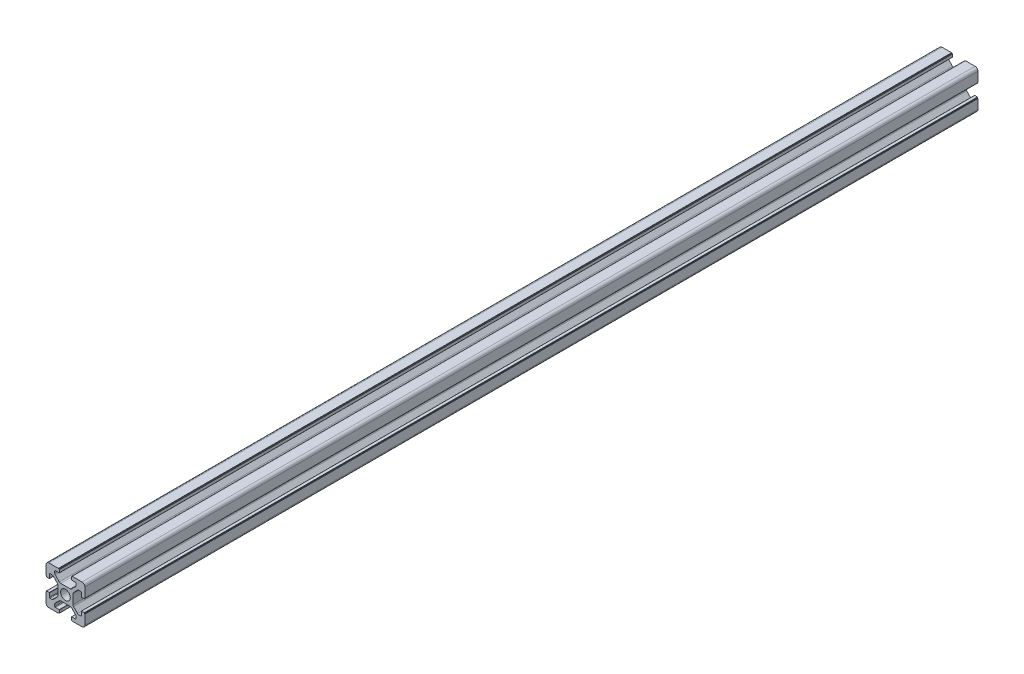
from build123d import *

# Parameters (mm, degrees)
SKETCH_1_R      = 2.5
EXTRUDE_1_DEPTH = 460
FILLET_1_R      = 1.5


with BuildPart() as part:
    # 草图1 → 凸台-拉伸1 (new body)
    with BuildSketch(Plane.XY):
        with BuildLine():
            Line((20, 13.6), (20, 20))
            Line((20, 20), (13.6, 20))
            Line((13.6, 20), (13.6, 19.8))
            Line((13.6, 19.8), (13.2, 19.8))
            ThreePointArc((13.2, 19.8), (13.129289322, 19.770710678), (13.1, 19.7))
            Line((13.1, 19.7), (13.1, 18.3))
            ThreePointArc((13.1, 18.3), (13.129289322, 18.229289322), (13.2, 18.2))
            Line((13.2, 18.2), (15.2, 18.2))
            ThreePointArc((15.2, 18.2), (15.412132034, 18.112132034), (15.5, 17.9))
            Line((15.5, 17.9), (15.5, 16.974873734))
            ThreePointArc((15.5, 16.974873734), (15.423879533, 16.592190302), (15.207106781, 16.267766953))
            Line((15.207106781, 16.267766953), (13.132233047, 14.192893219))
            ThreePointArc((13.132233047, 14.192893219), (12.807809698, 13.976120467), (12.425126266, 13.9))
            Line((12.425126266, 13.9), (7.574873734, 13.9))
            ThreePointArc((7.574873734, 13.9), (7.192190302, 13.976120467), (6.867766953, 14.192893219))
            Line((6.867766953, 14.192893219), (4.792893219, 16.267766953))
            ThreePointArc((4.792893219, 16.267766953), (4.576120467, 16.592190302), (4.5, 16.974873734))
            Line((4.5, 16.974873734), (4.5, 17.9))
            ThreePointArc((4.5, 17.9), (4.587867966, 18.112132034), (4.8, 18.2))
            Line((4.8, 18.2), (6.8, 18.2))
            ThreePointArc((6.8, 18.2), (6.870710678, 18.229289322), (6.9, 18.3))
            Line((6.9, 18.3), (6.9, 19.7))
            ThreePointArc((6.9, 19.7), (6.870710678, 19.770710678), (6.8, 19.8))
            Line((6.8, 19.8), (6.4, 19.8))
            Line((6.4, 19.8), (6.4, 20))
            Line((6.4, 20), (0, 20))
            Line((0, 20), (0, 13.6))
            Line((0, 13.6), (0.2, 13.6))
            Line((0.2, 13.6), (0.2, 13.2))
            ThreePointArc((0.2, 13.2), (0.229289322, 13.129289322), (0.3, 13.1))
            Line((0.3, 13.1), (1.7, 13.1))
            ThreePointArc((1.7, 13.1), (1.770710678, 13.129289322), (1.8, 13.2))
            Line((1.8, 13.2), (1.8, 15.2))
            ThreePointArc((1.8, 15.2), (1.887867966, 15.412132034), (2.1, 15.5))
            Line((2.1, 15.5), (3.025126266, 15.5))
            ThreePointArc((3.025126266, 15.5), (3.407809698, 15.423879533), (3.732233047, 15.207106781))
            Line((3.732233047, 15.207106781), (5.807106781, 13.132233047))
            ThreePointArc((5.807106781, 13.132233047), (6.023879533, 12.807809698), (6.1, 12.425126266))
            Line((6.1, 12.425126266), (6.1, 7.574873734))
            ThreePointArc((6.1, 7.574873734), (6.023879533, 7.192190302), (5.807106781, 6.867766953))
            Line((5.807106781, 6.867766953), (3.732233047, 4.792893219))
            ThreePointArc((3.732233047, 4.792893219), (3.407809698, 4.576120467), (3.025126266, 4.5))
            Line((3.025126266, 4.5), (2.1, 4.5))
            ThreePointArc((2.1, 4.5), (1.887867966, 4.587867966), (1.8, 4.8))
            Line((1.8, 4.8), (1.8, 6.8))
            ThreePointArc((1.8, 6.8), (1.770710678, 6.870710678), (1.7, 6.9))
            Line((1.7, 6.9), (0.3, 6.9))
            ThreePointArc((0.3, 6.9), (0.229289322, 6.870710678), (0.2, 6.8))
            Line((0.2, 6.8), (0.2, 6.4))
            Line((0.2, 6.4), (0, 6.4))
            Line((0, 6.4), (0, 0))
            Line((0, 0), (6.4, 0))
            Line((6.4, 0), (6.4, 0.2))
            Line((6.4, 0.2), (6.8, 0.2))
            ThreePointArc((6.8, 0.2), (6.870710678, 0.229289322), (6.9, 0.3))
            Line((6.9, 0.3), (6.9, 1.7))
            ThreePointArc((6.9, 1.7), (6.870710678, 1.770710678), (6.8, 1.8))
            Line((6.8, 1.8), (4.8, 1.8))
            ThreePointArc((4.8, 1.8), (4.587867966, 1.887867966), (4.5, 2.1))
            Line((4.5, 2.1), (4.5, 3.025126266))
            ThreePointArc((4.5, 3.025126266), (4.576120467, 3.407809698), (4.792893219, 3.732233047))
            Line((4.792893219, 3.732233047), (6.867766953, 5.807106781))
            ThreePointArc((6.867766953, 5.807106781), (7.192190302, 6.023879533), (7.574873734, 6.1))
            Line((7.574873734, 6.1), (12.425126266, 6.1))
            ThreePointArc((12.425126266, 6.1), (12.807809698, 6.023879533), (13.132233047, 5.807106781))
            Line((13.132233047, 5.807106781), (15.207106781, 3.732233047))
            ThreePointArc((15.207106781, 3.732233047), (15.423879533, 3.407809698), (15.5, 3.025126266))
            Line((15.5, 3.025126266), (15.5, 2.1))
            ThreePointArc((15.5, 2.1), (15.412132034, 1.887867966), (15.2, 1.8))
            Line((15.2, 1.8), (13.2, 1.8))
            ThreePointArc((13.2, 1.8), (13.129289322, 1.770710678), (13.1, 1.7))
            Line((13.1, 1.7), (13.1, 0.3))
            ThreePointArc((13.1, 0.3), (13.129289322, 0.229289322), (13.2, 0.2))
            Line((13.2, 0.2), (13.6, 0.2))
            Line((13.6, 0.2), (13.6, 0))
            Line((13.6, 0), (20, 0))
            Line((20, 0), (20, 6.4))
            Line((20, 6.4), (19.8, 6.4))
            Line((19.8, 6.4), (19.8, 6.8))
            ThreePointArc((19.8, 6.8), (19.770710678, 6.870710678), (19.7, 6.9))
            Line((19.7, 6.9), (18.3, 6.9))
            ThreePointArc((18.3, 6.9), (18.229289322, 6.870710678), (18.2, 6.8))
            Line((18.2, 6.8), (18.2, 4.8))
            ThreePointArc((18.2, 4.8), (18.112132034, 4.587867966), (17.9, 4.5))
            Line((17.9, 4.5), (16.974873734, 4.5))
            ThreePointArc((16.974873734, 4.5), (16.592190302, 4.576120467), (16.267766953, 4.792893219))
            Line((16.267766953, 4.792893219), (14.192893219, 6.867766953))
            ThreePointArc((14.192893219, 6.867766953), (13.976120467, 7.192190302), (13.9, 7.574873734))
            Line((13.9, 7.574873734), (13.9, 12.425126266))
            ThreePointArc((13.9, 12.425126266), (13.976120467, 12.807809698), (14.192893219, 13.132233047))
            Line((14.192893219, 13.132233047), (16.267766953, 15.207106781))
            ThreePointArc((16.267766953, 15.207106781), (16.592190302, 15.423879533), (16.974873734, 15.5))
            Line((16.974873734, 15.5), (17.9, 15.5))
            ThreePointArc((17.9, 15.5), (18.112132034, 15.412132034), (18.2, 15.2))
            Line((18.2, 15.2), (18.2, 13.2))
            ThreePointArc((18.2, 13.2), (18.229289322, 13.129289322), (18.3, 13.1))
            Line((18.3, 13.1), (19.7, 13.1))
            ThreePointArc((19.7, 13.1), (19.770710678, 13.129289322), (19.8, 13.2))
            Line((19.8, 13.2), (19.8, 13.6))
            Line((19.8, 13.6), (20, 13.6))
        make_face()
        with Locations((10, 10)):
            Circle(SKETCH_1_R, mode=Mode.SUBTRACT)
    extrude(amount=EXTRUDE_1_DEPTH)

    # 圆角1
    fillet_1_edges = [part.edges().sort_by_distance(p)[0] for p in [
        (0, 0, 230),
        (0, 20, 230),
        (20, 20, 230),
        (20, 0, 230),
    ]]
    fillet(fillet_1_edges, radius=FILLET_1_R)


solid = part.part
